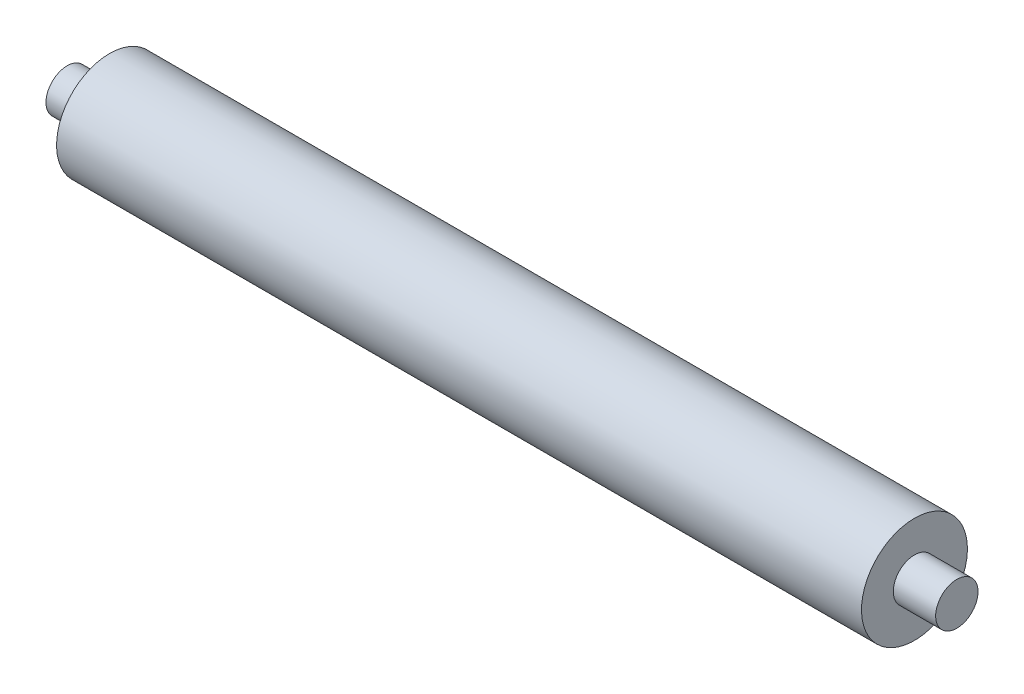
from build123d import *


with BuildPart() as part:
    # Sketch2 → Revolve1 (revolve)
    with BuildSketch(Plane.XY):
        Polygon((0, 0), (0, 5), (10, 5), (10, 12.5), (200, 12.5), (200, 5), (210, 5), (210, 0), align=None)
    revolve(axis=Axis((210, 0, 0), (-1, 0, 0)))


solid = part.part
